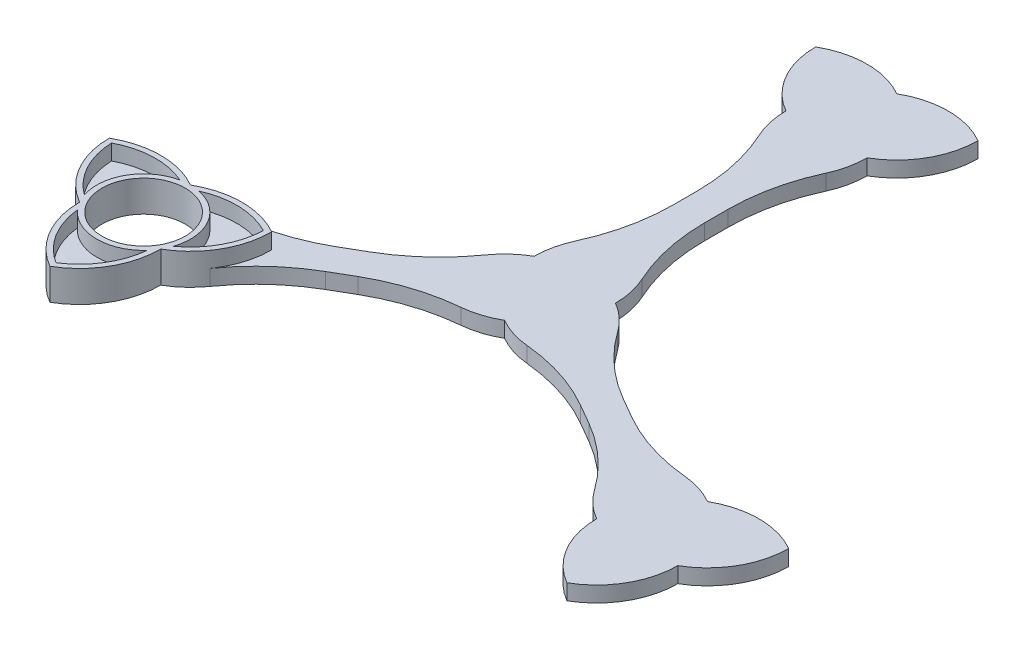
from build123d import *

# Parameters (mm, degrees)
BOSS_EXTRUDE2_DEPTH    = 3
SKETCH12_R             = 8
BOSS_EXTRUDE3_DEPTH    = 3
CUT_EXTRUDE1_START     = -3
SKETCH15_R             = 8
CUT_EXTRUDE1_DEPTH     = 3
SPLIT1_SURFACE_1_BACK  = 175.059
SPLIT1_SURFACE_1_DEPTH = 350.118
SPLIT1_SURFACE_2_BACK  = 175.059
SPLIT1_SURFACE_2_DEPTH = 350.118


with BuildPart() as part:
    # Sketch3 → Boss-Extrude2 (new body)
    with BuildSketch(Plane(origin=(0, 0, 0), x_dir=(1, 0, 0), z_dir=(0, 1, 0))):
        with BuildLine():
            ThreePointArc((-49.641016151, 10.660254038), (-53.367697775, 13.659367084), (-56.009477801, 17.647328127))
            ThreePointArc((-56.009477801, 17.647328127), (-57.074631953, 20.826674302), (-57.435244785, 24.160254038))
            ThreePointArc((-57.435244785, 24.160254038), (-63.141016151, 29.866025404), (-65.229473419, 37.660254038))
            ThreePointArc((-65.229473419, 37.660254038), (-57.435244785, 39.748711306), (-49.641016151, 37.660254038))
            ThreePointArc((-49.641016151, 37.660254038), (-46.573744998, 39.014744032), (-43.287773367, 39.681966565))
            ThreePointArc((-43.287773367, 39.681966565), (-35.524464535, 41.258320585), (-28.27784895, 44.458385987))
            Line((-28.27784895, 44.458385987), (-26.320508076, 45.588457268))
            Line((-26.320508076, 45.588457268), (-24.363167201, 46.718528549))
            ThreePointArc((-24.363167201, 46.718528549), (-17.968521476, 51.394249035), (-12.721704434, 57.329294692))
            ThreePointArc((-12.721704434, 57.329294692), (-10.500886954, 59.841418334), (-7.794228634, 61.820508076))
            ThreePointArc((-7.794228634, 61.820508076), (-5.705771366, 69.61473671), (0, 75.320508076))
            ThreePointArc((0, 75.320508076), (5.705771366, 69.61473671), (7.794228634, 61.820508076))
            ThreePointArc((7.794228634, 61.820508076), (10.500886954, 59.841418334), (12.721704434, 57.329294692))
            ThreePointArc((12.721704434, 57.329294692), (17.968521476, 51.394249035), (24.363167201, 46.718528549))
            Line((24.363167201, 46.718528549), (26.320508076, 45.588457268))
            Line((26.320508076, 45.588457268), (28.27784895, 44.458385987))
            ThreePointArc((28.27784895, 44.458385987), (35.524464535, 41.258320585), (43.287773367, 39.681966565))
            ThreePointArc((43.287773367, 39.681966565), (46.573744998, 39.014744032), (49.641016151, 37.660254038))
            ThreePointArc((49.641016151, 37.660254038), (57.435244785, 39.748711306), (65.229473419, 37.660254038))
            ThreePointArc((65.229473419, 37.660254038), (63.141016151, 29.866025404), (57.435244785, 24.160254038))
            ThreePointArc((57.435244785, 24.160254038), (57.074631953, 20.826674302), (56.009477801, 17.647328127))
            ThreePointArc((56.009477801, 17.647328127), (53.367697775, 13.659367084), (49.641016151, 10.660254038))
            ThreePointArc((49.641016151, 10.660254038), (45.914334527, 13.659367084), (43.272554502, 17.647328127))
            ThreePointArc((43.272554502, 17.647328127), (42.20740035, 20.826674302), (41.846787517, 24.160254038))
            ThreePointArc((41.846787517, 24.160254038), (39.140129197, 26.13934378), (36.919311718, 28.651467422))
            ThreePointArc((36.919311718, 28.651467422), (31.672494675, 34.586513078), (25.27784895, 39.262233565))
            Line((25.27784895, 39.262233565), (23.320508076, 40.392304845))
            Line((23.320508076, 40.392304845), (21.363167201, 41.522376126))
            ThreePointArc((21.363167201, 41.522376126), (14.116551616, 44.722441529), (6.353242784, 46.298795548))
            ThreePointArc((6.353242784, 46.298795548), (3.067271153, 46.966018082), (0, 48.320508076))
            ThreePointArc((0, 48.320508076), (-3.067271153, 46.966018082), (-6.353242784, 46.298795548))
            ThreePointArc((-6.353242784, 46.298795548), (-14.116551616, 44.722441529), (-21.363167201, 41.522376126))
            Line((-21.363167201, 41.522376126), (-23.320508076, 40.392304845))
            Line((-23.320508076, 40.392304845), (-25.27784895, 39.262233565))
            ThreePointArc((-25.27784895, 39.262233565), (-31.672494675, 34.586513078), (-36.919311718, 28.651467422))
            ThreePointArc((-36.919311718, 28.651467422), (-39.140129197, 26.13934378), (-41.846787517, 24.160254038))
            ThreePointArc((-41.846787517, 24.160254038), (-42.20740035, 20.826674302), (-43.272554502, 17.647328127))
            ThreePointArc((-43.272554502, 17.647328127), (-45.914334527, 13.659367084), (-49.641016151, 10.660254038))
        make_face()
        with BuildLine():
            Line((-3, 85.980762114), (-3, 83.720619552))
            ThreePointArc((-3, 83.720619552), (-3.85196986, 75.844833663), (-6.36846165, 68.333433987))
            ThreePointArc((-6.36846165, 68.333433987), (-3.726681624, 72.32139503), (0, 75.320508076))
            ThreePointArc((0, 75.320508076), (3.726681624, 72.32139503), (6.36846165, 68.333433987))
            ThreePointArc((6.36846165, 68.333433987), (3.85196986, 75.844833663), (3, 83.720619552))
            Line((3, 83.720619552), (3, 85.980762114))
            Line((3, 85.980762114), (3, 88.240904675))
            ThreePointArc((3, 88.240904675), (3.85196986, 96.116690564), (6.36846165, 103.62809024))
            ThreePointArc((6.36846165, 103.62809024), (7.433615801, 106.807436416), (7.794228634, 110.141016151))
            ThreePointArc((7.794228634, 110.141016151), (10.500886954, 112.120105893), (12.721704434, 114.632229535))
            ThreePointArc((12.721704434, 114.632229535), (14.854489994, 118.91405867), (15.588457268, 123.641016151))
            ThreePointArc((15.588457268, 123.641016151), (11.12780837, 125.368860587), (6.353242784, 125.662728679))
            ThreePointArc((6.353242784, 125.662728679), (3.067271153, 124.995506145), (0, 123.641016151))
            ThreePointArc((0, 123.641016151), (-7.794228634, 125.729473419), (-15.588457268, 123.641016151))
            ThreePointArc((-15.588457268, 123.641016151), (-13.5, 115.846787517), (-7.794228634, 110.141016151))
            ThreePointArc((-7.794228634, 110.141016151), (-7.433615801, 106.807436416), (-6.36846165, 103.62809024))
            ThreePointArc((-6.36846165, 103.62809024), (-3.85196986, 96.116690564), (-3, 88.240904675))
            Line((-3, 88.240904675), (-3, 85.980762114))
        make_face()
    extrude(amount=BOSS_EXTRUDE2_DEPTH)

    # Sketch12 → Boss-Extrude3 (add)
    with BuildSketch(Plane(origin=(0, 3, 0), x_dir=(1, 0, 0), z_dir=(0, 1, 0))):
        with BuildLine():
            ThreePointArc((-57.435244785, 24.160254038), (-55.346787517, 16.366025404), (-49.641016151, 10.660254038))
            ThreePointArc((-49.641016151, 10.660254038), (-43.935244785, 16.366025404), (-41.846787517, 24.160254038))
            ThreePointArc((-41.846787517, 24.160254038), (-36.141016151, 29.866025404), (-34.052558883, 37.660254038))
            ThreePointArc((-34.052558883, 37.660254038), (-41.846787517, 39.748711306), (-49.641016151, 37.660254038))
            ThreePointArc((-49.641016151, 37.660254038), (-57.435244785, 39.748711306), (-65.229473419, 37.660254038))
            ThreePointArc((-65.229473419, 37.660254038), (-63.141016151, 29.866025404), (-57.435244785, 24.160254038))
        make_face()
        with BuildLine():
            ThreePointArc((-41.095384464, 25.83674929), (-41.846787517, 33.160254038), (-47.813427147, 37.472740545))
            ThreePointArc((-47.813427147, 37.472740545), (-41.393201216, 38.741658117), (-35.064256985, 37.076149866))
            ThreePointArc((-35.064256985, 37.076149866), (-36.786356645, 30.762369258), (-41.095384464, 25.83674929))
        make_face(mode=Mode.SUBTRACT)
        with BuildLine():
            ThreePointArc((-42.922973468, 22.671272279), (-45.03417158, 16.476734738), (-49.641016151, 11.828462381))
            ThreePointArc((-49.641016151, 11.828462381), (-54.247860722, 16.476734738), (-56.359058835, 22.671272279))
            ThreePointArc((-56.359058835, 22.671272279), (-49.641016151, 19.660254038), (-42.922973468, 22.671272279))
        make_face(mode=Mode.SUBTRACT)
        with BuildLine():
            ThreePointArc((-51.468605156, 37.472740545), (-57.435244785, 33.160254038), (-58.186647839, 25.83674929))
            ThreePointArc((-58.186647839, 25.83674929), (-62.495675658, 30.762369258), (-64.217775317, 37.076149866))
            ThreePointArc((-64.217775317, 37.076149866), (-57.888831087, 38.741658117), (-51.468605156, 37.472740545))
        make_face(mode=Mode.SUBTRACT)
        with Locations(Location((-49.641016151, 28.660254038, 0), (0, 0, 270))):
            Circle(SKETCH12_R, mode=Mode.SUBTRACT)
    extrude(amount=BOSS_EXTRUDE3_DEPTH)

    # Sketch15 → Cut-Extrude1 (cut)
    with BuildSketch(Plane(origin=(0, 3, 0), x_dir=(1, 0, 0), z_dir=(0, 1, 0)).offset(CUT_EXTRUDE1_START)):
        with Locations(Location((-49.641016151, 28.660254038, 0), (0, 0, 270))):
            Circle(SKETCH15_R)
    extrude(amount=CUT_EXTRUDE1_DEPTH, mode=Mode.SUBTRACT)


with BuildPart() as body_2:
    # Split1: the piece behind the surface
    add(part.part)
    # Split1 surface: a surface, the sketch's curves swept straight by 350.118 mm
    with BuildLine(Plane(origin=(0, 3, 0), x_dir=(1, 0, 0), z_dir=(0, 1, 0)).offset(-SPLIT1_SURFACE_1_BACK), mode=Mode.PRIVATE) as split1_surface_1_path:
        ThreePointArc((-43.287773367, 39.681966565), (-38.513207782, 39.388098473), (-34.052558883, 37.660254038))
        ThreePointArc((-34.052558883, 37.660254038), (-34.786526158, 32.933296557), (-36.919311718, 28.651467422))
    split1_surface_1 = Shell.extrude(split1_surface_1_path.wire(), (0 * SPLIT1_SURFACE_1_DEPTH, 1 * SPLIT1_SURFACE_1_DEPTH, 0 * SPLIT1_SURFACE_1_DEPTH))
    split(bisect_by=split1_surface_1, keep=Keep.BOTTOM)


with BuildPart() as part_1:
    add(part.part)

    # Split1: split by a surface, the side it looks to stays
    # Split1 surface: a surface, the sketch's curves swept straight by 350.118 mm
    with BuildLine(Plane(origin=(0, 3, 0), x_dir=(1, 0, 0), z_dir=(0, 1, 0)).offset(-SPLIT1_SURFACE_2_BACK), mode=Mode.PRIVATE) as split1_surface_2_path:
        ThreePointArc((-43.287773367, 39.681966565), (-38.513207782, 39.388098473), (-34.052558883, 37.660254038))
        ThreePointArc((-34.052558883, 37.660254038), (-34.786526158, 32.933296557), (-36.919311718, 28.651467422))
    split1_surface_2 = Shell.extrude(split1_surface_2_path.wire(), (0 * SPLIT1_SURFACE_2_DEPTH, 1 * SPLIT1_SURFACE_2_DEPTH, 0 * SPLIT1_SURFACE_2_DEPTH))
    split(bisect_by=split1_surface_2, keep=Keep.TOP)


solid = Compound([body_2.part, part_1.part])
